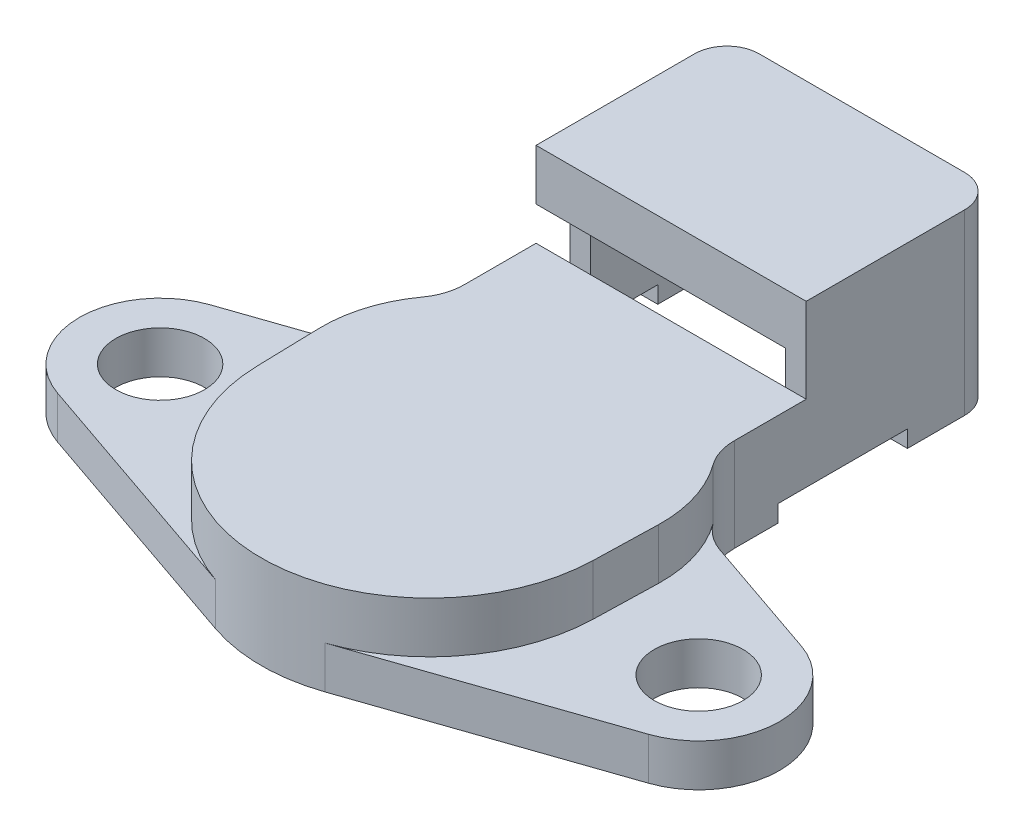
from build123d import *

# Parameters (mm, degrees)
BOSS_EXTRUDE1_DEPTH   = 1
SKETCH3_R             = 2.6162
BOSS_EXTRUDE1_2_DEPTH = 1
SKETCH4_R             = 2.6162
BOSS_EXTRUDE2_DEPTH   = 1.5
BOSS_EXTRUDE3_DEPTH   = 3
SKETCH6_W             = 15.9258
SKETCH6_H             = 11.25
BOSS_EXTRUDE4_DEPTH   = 5
SKETCH7_W             = 13.5128
SKETCH7_H             = 10
CUT_EXTRUDE1_DEPTH    = 5
CUT_EXTRUDE2_DEPTH    = 5
FILLET1_R             = 2.54
FILLET2_R             = 2.54
FILLET3_R             = 7.62
FILLET4_R             = 1.905


with BuildPart() as part:
    # Sketch3 → Boss-Extrude1 (new body)
    with BuildSketch(Plane(origin=(0, 0, 0), x_dir=(1, 0, 0), z_dir=(0, 1, 0))):
        Polygon((6.7564, 24.25), (6.7564, 20.22), (7.9629, 20.22), (7.9629, 25.5), (-7.9629, 25.5), (-7.9629, 20.22), (-6.7564, 20.22), (-6.7564, 24.25), align=None)
    extrude(amount=BOSS_EXTRUDE1_DEPTH)



with BuildPart() as body_2:
    # Sketch3 → Boss-Extrude1 2 (new body)
    with BuildSketch(Plane(origin=(0, 0, 0), x_dir=(1, 0, 0), z_dir=(0, 1, 0))):
        with BuildLine():
            Line((6.7564, 12.6), (6.7564, 4.876812672))
            ThreePointArc((6.7564, 4.876812672), (6.776225919, 4.847421317), (6.796505263, 4.818340964))
            ThreePointArc((6.796505263, 4.818340964), (0, -8.3312), (-6.796505263, 4.818340964))
            ThreePointArc((-6.796505263, 4.818340964), (-6.776225919, 4.847421317), (-6.7564, 4.876812672))
            Line((-6.7564, 4.876812672), (-6.7564, 12.6))
            Line((-6.7564, 12.6), (-7.9629, 12.6))
            Line((-7.9629, 12.6), (-7.9629, 10.019330915))
            ThreePointArc((-7.9629, 10.019330915), (-8.553832276, 8.174549356), (-10.10666, 7.016470768))
            Line((-10.10666, 7.016470768), (-17.42186, 4.50429022))
            ThreePointArc((-17.42186, 4.50429022), (-20.6375, 0), (-17.42186, -4.50429022))
            Line((-17.42186, -4.50429022), (-3.22159376, -9.380935099))
            ThreePointArc((-3.22159376, -9.380935099), (0, -9.9187), (3.22159376, -9.380935099))
            Line((3.22159376, -9.380935099), (17.42186, -4.50429022))
            ThreePointArc((17.42186, -4.50429022), (20.6375, 0), (17.42186, 4.50429022))
            Line((17.42186, 4.50429022), (10.10666, 7.016470768))
            ThreePointArc((10.10666, 7.016470768), (8.553832276, 8.174549356), (7.9629, 10.019330915))
            Line((7.9629, 10.019330915), (7.9629, 12.6))
            Line((7.9629, 12.6), (6.7564, 12.6))
        make_face()
        with Locations(Location((-15.875, 0, 0), (0, 0, 270))):
            Circle(SKETCH3_R, mode=Mode.SUBTRACT)
        with Locations(Location((15.875, 0, 0), (0, 0, 270))):
            Circle(SKETCH3_R, mode=Mode.SUBTRACT)
    extrude(amount=BOSS_EXTRUDE1_2_DEPTH)


with BuildPart() as part_1:
    add(part.part)

    add(body_2.part)  # Boss-Extrude2 merges body 2
    # Sketch4 → Boss-Extrude2 (add)
    with BuildSketch(Plane(origin=(0, 1, 0), x_dir=(1, 0, 0), z_dir=(0, 1, 0))):
        with BuildLine():
            Line((7.9629, 20.22), (7.9629, 25.5))
            Line((7.9629, 25.5), (-7.9629, 25.5))
            Line((-7.9629, 25.5), (-7.9629, 20.22))
            Line((-7.9629, 20.22), (-7.9629, 12.6))
            Line((-7.9629, 12.6), (-7.9629, 10.019330915))
            ThreePointArc((-7.9629, 10.019330915), (-8.553832276, 8.174549356), (-10.10666, 7.016470768))
            Line((-10.10666, 7.016470768), (-17.42186, 4.50429022))
            ThreePointArc((-17.42186, 4.50429022), (-20.6375, 0), (-17.42186, -4.50429022))
            Line((-17.42186, -4.50429022), (-3.22159376, -9.380935099))
            ThreePointArc((-3.22159376, -9.380935099), (0, -9.9187), (3.22159376, -9.380935099))
            Line((3.22159376, -9.380935099), (17.42186, -4.50429022))
            ThreePointArc((17.42186, -4.50429022), (20.6375, 0), (17.42186, 4.50429022))
            Line((17.42186, 4.50429022), (10.10666, 7.016470768))
            ThreePointArc((10.10666, 7.016470768), (8.553832276, 8.174549356), (7.9629, 10.019330915))
            Line((7.9629, 10.019330915), (7.9629, 12.6))
            Line((7.9629, 12.6), (7.9629, 20.22))
        make_face()
        with Locations(Location((15.875, 0, 0), (0, 0, 270))):
            Circle(SKETCH4_R, mode=Mode.SUBTRACT)
        with Locations(Location((-15.875, 0, 0), (0, 0, 270))):
            Circle(SKETCH4_R, mode=Mode.SUBTRACT)
        with BuildLine():
            Line((-6.7564, 24.25), (6.7564, 24.25))
            Line((6.7564, 24.25), (6.7564, 20.22))
            Line((6.7564, 20.22), (6.7564, 12.6))
            Line((6.7564, 12.6), (6.7564, 4.876812672))
            ThreePointArc((6.7564, 4.876812672), (6.776225919, 4.847421317), (6.796505263, 4.818340964))
            ThreePointArc((6.796505263, 4.818340964), (0, -8.3312), (-6.796505263, 4.818340964))
            ThreePointArc((-6.796505263, 4.818340964), (-6.776225919, 4.847421317), (-6.7564, 4.876812672))
            Line((-6.7564, 4.876812672), (-6.7564, 12.6))
            Line((-6.7564, 12.6), (-6.7564, 20.22))
            Line((-6.7564, 20.22), (-6.7564, 24.25))
        make_face(mode=Mode.SUBTRACT)
    extrude(amount=BOSS_EXTRUDE2_DEPTH)

    # Sketch5 → Boss-Extrude3 (add)
    # profile 1 of 2: a face of its own
    with BuildSketch(Plane(origin=(0, 2.5, 0), x_dir=(1, 0, 0), z_dir=(0, 1, 0))):
        with BuildLine():
            Line((-10.10666, 7.016470768), (-9.91527155, -0.260767662))
            ThreePointArc((-9.91527155, -0.260767662), (-7.996166023, -5.868725468), (-3.22159376, -9.380935099))
            ThreePointArc((-3.22159376, -9.380935099), (0, -9.9187), (3.22159376, -9.380935099))
            ThreePointArc((3.22159376, -9.380935099), (7.996166023, -5.868725468), (9.91527155, -0.260767662))
            Line((9.91527155, -0.260767662), (10.10666, 7.016470768))
            ThreePointArc((10.10666, 7.016470768), (8.553832276, 8.174549356), (7.9629, 10.019330915))
            Line((7.9629, 10.019330915), (7.9629, 25.5))
            Line((7.9629, 25.5), (-7.9629, 25.5))
            Line((-7.9629, 25.5), (-7.9629, 10.019330915))
            ThreePointArc((-7.9629, 10.019330915), (-8.553832276, 8.174549356), (-10.10666, 7.016470768))
        make_face()
        with BuildLine():
            Line((-6.7564, 4.876812672), (-6.7564, 24.25))
            Line((-6.7564, 24.25), (6.7564, 24.25))
            Line((6.7564, 24.25), (6.7564, 4.876812672))
            ThreePointArc((6.7564, 4.876812672), (6.776225919, 4.847421317), (6.796505263, 4.818340964))
            ThreePointArc((6.796505263, 4.818340964), (0, -8.3312), (-6.796505263, 4.818340964))
            ThreePointArc((-6.796505263, 4.818340964), (-6.776225919, 4.847421317), (-6.7564, 4.876812672))
        make_face(mode=Mode.SUBTRACT)
    # profile 2 of 2: a face of its own
    with BuildSketch(Plane(origin=(0, 2.5, 0), x_dir=(1, 0, 0), z_dir=(0, 1, 0))):
        with BuildLine():
            ThreePointArc((-6.796505263, 4.818340964), (-6.776225919, 4.847421317), (-6.7564, 4.876812672))
            Line((-6.7564, 4.876812672), (-6.7564, 24.25))
            Line((-6.7564, 24.25), (6.7564, 24.25))
            Line((6.7564, 24.25), (6.7564, 4.876812672))
            ThreePointArc((6.7564, 4.876812672), (6.776225919, 4.847421317), (6.796505263, 4.818340964))
            ThreePointArc((6.796505263, 4.818340964), (0, -8.3312), (-6.796505263, 4.818340964))
        make_face()
    extrude(amount=BOSS_EXTRUDE3_DEPTH)

    # Sketch6 → Boss-Extrude4 (add)
    with BuildSketch(Plane(origin=(0, 5.5, 0), x_dir=(1, 0, 0), z_dir=(0, 1, 0))):
        with Locations((0, 19.875)):
            Rectangle(SKETCH6_W, SKETCH6_H)
    extrude(amount=BOSS_EXTRUDE4_DEPTH)

    # Sketch7 → Cut-Extrude1 (cut)
    with BuildSketch(Plane.XZ.offset(-2.5)):
        with Locations((0, -19.25)):
            Rectangle(SKETCH7_W, SKETCH7_H)
    extrude(amount=-CUT_EXTRUDE1_DEPTH, mode=Mode.SUBTRACT)

    # Sketch8 → Cut-Extrude2 (cut)
    with BuildSketch(Plane.ZY.offset(7.9629)):
        Polygon((-16.25, 7.5), (-16.25, 1), (-14.25, 1), (-14.25, 5.5), (-14.25, 7.5), align=None)
    extrude(amount=-CUT_EXTRUDE2_DEPTH, mode=Mode.SUBTRACT)

    # Fillet1
    fillet1_edges = [part_1.edges().sort_by_distance(p)[0] for p in [
        (-6.7564, 1.25, -4.876812672),
    ]]
    fillet(fillet1_edges, radius=FILLET1_R)

    # Fillet2
    fillet2_edges = [part_1.edges().sort_by_distance(p)[0] for p in [
        (6.7564, 1.25, -4.876812672),
    ]]
    fillet(fillet2_edges, radius=FILLET2_R)

    # Fillet3
    fillet3_edges = [part_1.edges().sort_by_distance(p)[0] for p in [
        (10.10666, 4, -7.016470768),
        (-10.10666, 4, -7.016470768),
    ]]
    fillet(fillet3_edges, radius=FILLET3_R)

    # Fillet4
    fillet4_edges = [part_1.edges().sort_by_distance(p)[0] for p in [
        (-7.9629, 5.25, -25.5),
        (7.9629, 5.25, -25.5),
    ]]
    fillet(fillet4_edges, radius=FILLET4_R)


solid = part_1.part
